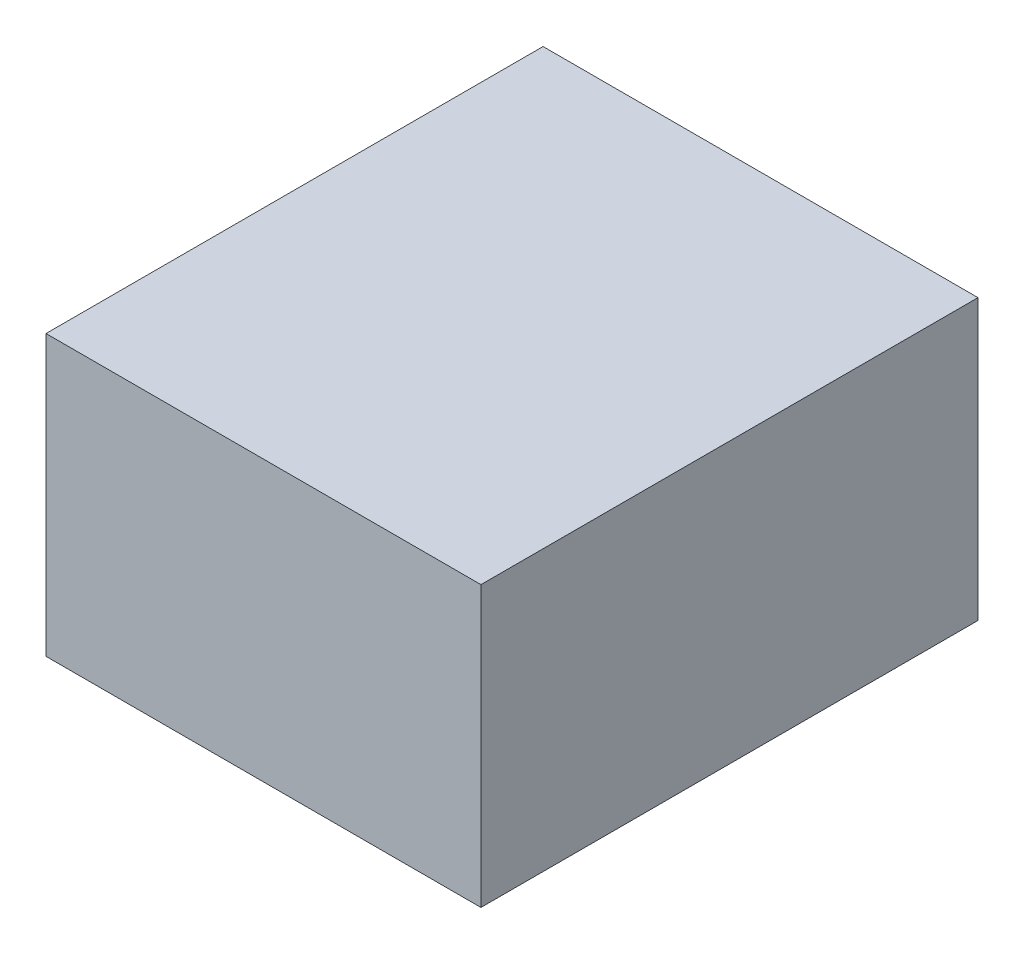
from build123d import *

# Parameters (mm, degrees)
BOSS_EXTRUDE1_START = -400
SKETCH1_W           = 700
SKETCH1_H           = 450
BOSS_EXTRUDE1_DEPTH = 800


with BuildPart() as part:
    # Sketch1 → Boss-Extrude1 (new body)
    with BuildSketch(Plane.XY.offset(BOSS_EXTRUDE1_START)):
        with Locations((250, -1650)):
            Rectangle(SKETCH1_W, SKETCH1_H)
    extrude(amount=BOSS_EXTRUDE1_DEPTH)


solid = part.part
